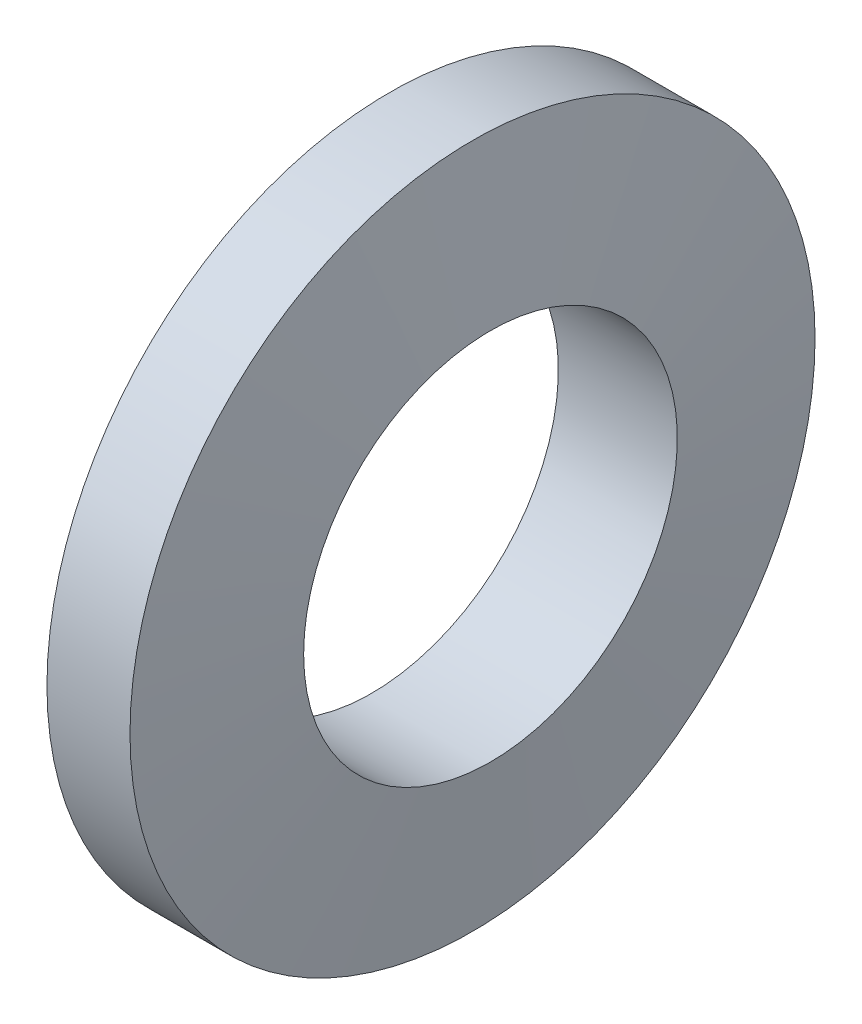
from build123d import *


with BuildPart() as part:
    # 草图2 → 旋转1 (revolve)
    with BuildSketch(Plane.XY, mode=Mode.PRIVATE) as revolve_1_sk:
        Polygon((-2, 16.5), (2, 16.5), (2.865384615, 9), (-2.865384615, 9), align=None)
    revolve(revolve_1_sk.sketch.rotate(Axis((0, 0, 0), (1, 0, 0)), 90), axis=Axis((0, 0, 0), (1, 0, 0)))


solid = part.part
